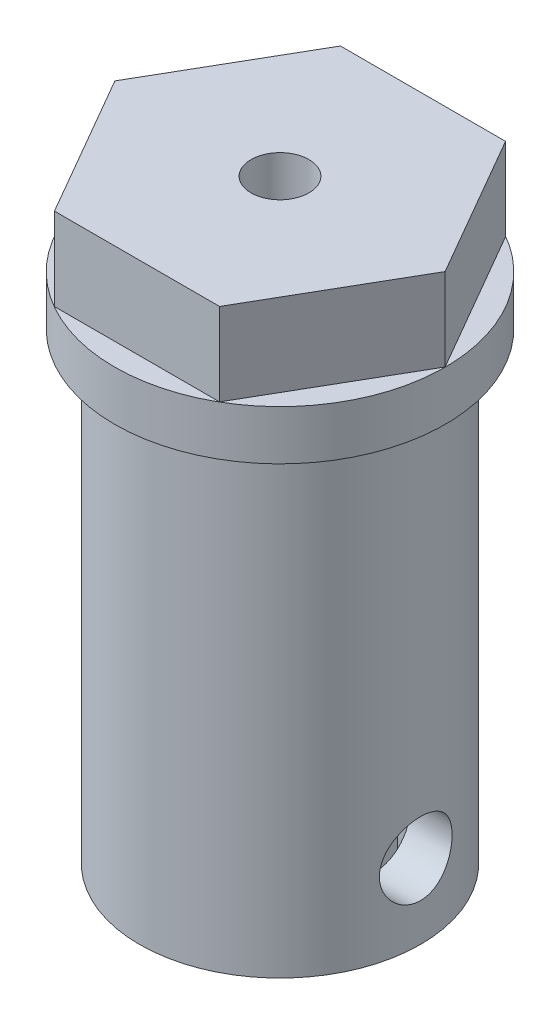
from build123d import *

# Parameters (mm, degrees)
SKETCH_1_R                           = 8.5
EXTRUDE_537_DEPTH                    = 28
SKETCH_2_R                           = 10
EXTRUDE_624_DEPTH                    = 3
EXTRUDE_747_DEPTH                    = 5
SKETCH_4_R                           = 3.15
CUT_EXTRUDE_845_DEPTH                = 12
SKETCH_5_W                           = 2.3
SKETCH_5_H                           = 7.5
CUT_EXTRUDE_1044_DEPTH               = 10
SKETCH_6_R                           = 2.2
CUT_EXTRUDE_1_DEPTH                  = 40.676472878
CUT_EXTRUDE_1_DIRECTION_2_REACH      = 41.676
CUT_EXTRUDE_1_DIRECTION_2_END_RADIUS = 3.15
SKETCH_7_R                           = 2.2
CUT_EXTRUDE_2_DEPTH                  = 40.984324454
CUT_EXTRUDE_2_DIRECTION_2_REACH      = 41.984
CUT_EXTRUDE_2_DIRECTION_2_END_RADIUS = 3.15
SKETCH_10_R                          = 1.75
CUT_EXTRUDE_1470_DEPTH               = 39.678159305


with BuildPart() as part:
    # Эскиз1 → Extrude 537 (new body)
    with BuildSketch(Plane(origin=(0, 0, 0), x_dir=(1, 0, 0), z_dir=(0, 1, 0))):
        with Locations(Location((0, 0, 0), (0, 0, 270))):
            Circle(SKETCH_1_R)
    extrude(amount=EXTRUDE_537_DEPTH)

    # Эскиз2 → Extrude 624 (add)
    with BuildSketch(Plane(origin=(0, 28, 0), x_dir=(1, 0, 0), z_dir=(0, 1, 0))):
        with Locations(Location((0, 0, 0), (0, 0, 270))):
            Circle(SKETCH_2_R)
    extrude(amount=EXTRUDE_624_DEPTH)

    # Эскиз3 → Extrude 747 (add)
    with BuildSketch(Plane(origin=(0, 31, 0), x_dir=(1, 0, 0), z_dir=(0, 1, 0))):
        Polygon((9.988159657, 0), (4.994079828, 8.65), (-4.994079828, 8.65), (-9.988159657, 0), (-4.994079828, -8.65), (4.994079828, -8.65), align=None)
    extrude(amount=EXTRUDE_747_DEPTH)

    # Эскиз4 → Cut-Extrude 845 (cut)
    with BuildSketch(Plane.XZ):
        with Locations(Location((0, 0, 0), (0, 0, 270))):
            Circle(SKETCH_4_R)
    extrude(amount=-CUT_EXTRUDE_845_DEPTH, mode=Mode.SUBTRACT)

    # Эскиз5 → Cut-Extrude 1044 (cut)
    with BuildSketch(Plane.XZ):
        with Locations((4.5, 0)):
            Rectangle(SKETCH_5_W, SKETCH_5_H)
        Polygon((-4.922595264, -1.026185103), (1.572595264, -4.776185103), (0.422595264, -6.768043531), (-6.072595264, -3.018043531), align=None)
    extrude(amount=-CUT_EXTRUDE_1044_DEPTH, mode=Mode.SUBTRACT)

    # Эскиз6 → отверстие чтоб прикрутить 1 (cut)
    with BuildSketch(Plane(origin=(3.35, 0, 0), x_dir=(0, 0, -1), z_dir=(1, 0, 0))):
        with Locations(Location((0, 4.5, 0), (0, 0, 180))):
            Circle(SKETCH_6_R)
    extrude(amount=CUT_EXTRUDE_1_DEPTH, mode=Mode.SUBTRACT)

    # отверстие чтоб прикрутить 1 direction 2: up to this cylinder (the profile starts outside it)
    cut_extrude_1_direction_2_end = Plane(origin=(0, 4.5, 0), z_dir=(0, -1, 0)) * Cylinder(CUT_EXTRUDE_1_DIRECTION_2_END_RADIUS, 90.652, mode=Mode.PRIVATE)
    # Эскиз6 → отверстие чтоб прикрутить 1 direction 2 (cut, up to the surface)
    with BuildSketch(Plane(origin=(3.35, 0, 0), x_dir=(0, 0, -1), z_dir=(1, 0, 0)), mode=Mode.PRIVATE) as cut_extrude_1_direction_2_sk1:
        with Locations(Location((0, 4.5, 0), (0, 0, 180))):
            Circle(SKETCH_6_R)
    cut_extrude_1_direction_2_tool1 = extrude(cut_extrude_1_direction_2_sk1.sketch, amount=-CUT_EXTRUDE_1_DIRECTION_2_REACH, mode=Mode.PRIVATE) - cut_extrude_1_direction_2_end
    add(cut_extrude_1_direction_2_tool1.solids().sort_by_distance((3.35, 4.5, 0))[0], mode=Mode.SUBTRACT)

    # Эскиз7 → отверстие чтоб прикрутить 2 (cut)
    with BuildSketch(Plane(origin=(-1.675, 0, -2.901185103), x_dir=(-0.8660254037844362, 0, 0.5000000000000042), z_dir=(-0.5000000000000043, 0, -0.8660254037844363))):
        with Locations(Location((0, 4.5, 0), (0, 0, 180))):
            Circle(SKETCH_7_R)
    extrude(amount=CUT_EXTRUDE_2_DEPTH, mode=Mode.SUBTRACT)

    # отверстие чтоб прикрутить 2 direction 2: up to this cylinder (the profile starts outside it)
    cut_extrude_2_direction_2_end = Plane(origin=(0, 4.5, 0), z_dir=(0, -1, 0)) * Cylinder(CUT_EXTRUDE_2_DIRECTION_2_END_RADIUS, 91.268, mode=Mode.PRIVATE)
    # Эскиз7 → отверстие чтоб прикрутить 2 direction 2 (cut, up to the surface)
    with BuildSketch(Plane(origin=(-1.675, 0, -2.901185103), x_dir=(-0.8660254037844362, 0, 0.5000000000000042), z_dir=(-0.5000000000000043, 0, -0.8660254037844363)), mode=Mode.PRIVATE) as cut_extrude_2_direction_2_sk1:
        with Locations(Location((0, 4.5, 0), (0, 0, 180))):
            Circle(SKETCH_7_R)
    cut_extrude_2_direction_2_tool1 = extrude(cut_extrude_2_direction_2_sk1.sketch, amount=-CUT_EXTRUDE_2_DIRECTION_2_REACH, mode=Mode.PRIVATE) - cut_extrude_2_direction_2_end
    add(cut_extrude_2_direction_2_tool1.solids().sort_by_distance((-1.675, 4.5, -2.901185))[0], mode=Mode.SUBTRACT)

    # Эскиз10 → Cut-Extrude 1470 (cut, through all)
    with BuildSketch(Plane(origin=(0, 36, 0), x_dir=(1, 0, 0), z_dir=(0, 1, 0))):
        with Locations(Location((0, 0, 0), (0, 0, 270))):
            Circle(SKETCH_10_R)
    extrude(amount=-CUT_EXTRUDE_1470_DEPTH, mode=Mode.SUBTRACT)


solid = part.part
